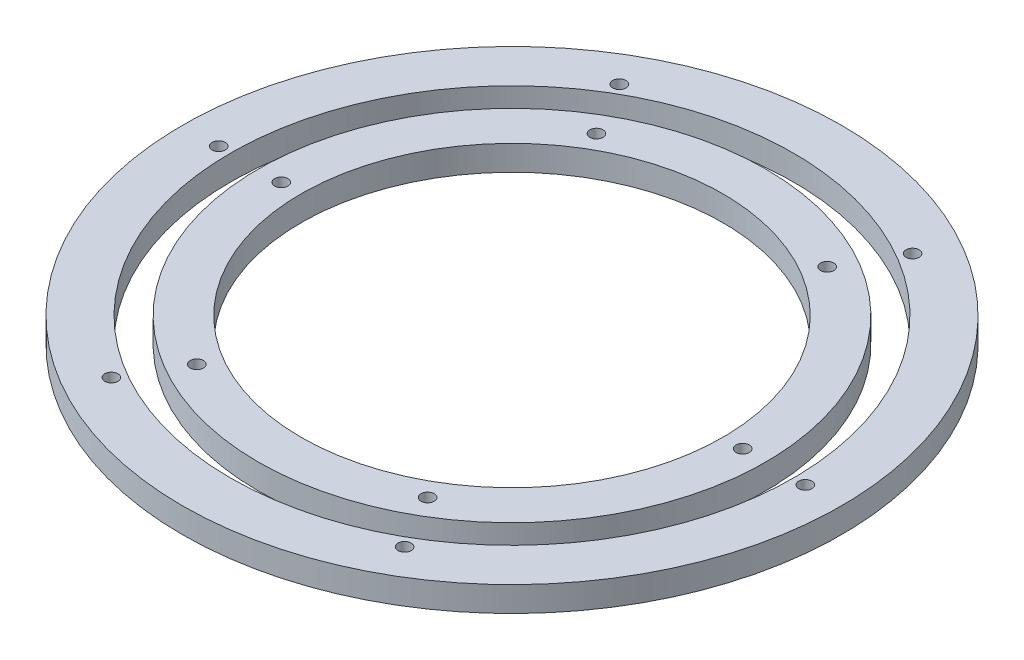
from build123d import *

# Parameters (mm, degrees)
SKETCH1_R           = 250
SKETCH1_R_2         = 160
BOSS_EXTRUDE1_DEPTH = 9.5
SKETCH2_R           = 213.5
SKETCH2_R_2         = 192.5
SKETCH2_R_3         = 5
CUT_EXTRUDE1_DEPTH  = 355.063553617
SKETCH3_R           = 5
CUT_EXTRUDE2_DEPTH  = 355.063553617


with BuildPart() as part:
    # Sketch1 → Boss-Extrude1 (new, symmetric)
    with BuildSketch(Plane(origin=(0, 0, 0), x_dir=(1, 0, 0), z_dir=(0, 1, 0))):
        with Locations(Location((0, 0, 0), (0, 0, 270))):
            Circle(SKETCH1_R)
        with Locations(Location((0, 0, 0), (0, 0, 270))):
            Circle(SKETCH1_R_2, mode=Mode.SUBTRACT)
    extrude(amount=BOSS_EXTRUDE1_DEPTH, both=True)

    # Sketch2 → Cut-Extrude1 (cut, through all)
    # profile 1 of 7: a face of its own
    with BuildSketch(Plane(origin=(0, 9.5, 0), x_dir=(1, 0, 0), z_dir=(0, 1, 0))):
        with Locations(Location((0, 0, 0), (0, 0, 270))):
            Circle(SKETCH2_R)
        with Locations(Location((0, 0, 0), (0, 0, 270))):
            Circle(SKETCH2_R_2, mode=Mode.SUBTRACT)
    # profile 2 of 7: a face of its own
    with BuildSketch(Plane(origin=(0, 9.5, 0), x_dir=(1, 0, 0), z_dir=(0, 1, 0))):
        with Locations(Location((111.25, 192.690652342, 0), (0, 0, 270))):
            Circle(SKETCH2_R_3)
    # profile 3 of 7: a face of its own
    with BuildSketch(Plane(origin=(0, 9.5, 0), x_dir=(1, 0, 0), z_dir=(0, 1, 0))):
        with Locations(Location((222.5, 0, 0), (0, 0, 270))):
            Circle(SKETCH2_R_3)
    # profile 4 of 7: a face of its own
    with BuildSketch(Plane(origin=(0, 9.5, 0), x_dir=(1, 0, 0), z_dir=(0, 1, 0))):
        with Locations(Location((-222.5, 0, 0), (0, 0, 90))):
            Circle(SKETCH2_R_3)
    # profile 5 of 7: a face of its own
    with BuildSketch(Plane(origin=(0, 9.5, 0), x_dir=(1, 0, 0), z_dir=(0, 1, 0))):
        with Locations(Location((-111.25, 192.690652342, 0), (0, 0, 90))):
            Circle(SKETCH2_R_3)
    # profile 6 of 7: a face of its own
    with BuildSketch(Plane(origin=(0, 9.5, 0), x_dir=(1, 0, 0), z_dir=(0, 1, 0))):
        with Locations(Location((111.25, -192.690652342, 0), (0, 0, 90))):
            Circle(SKETCH2_R_3)
    # profile 7 of 7: a face of its own
    with BuildSketch(Plane(origin=(0, 9.5, 0), x_dir=(1, 0, 0), z_dir=(0, 1, 0))):
        with Locations(Location((-111.25, -192.690652342, 0), (0, 0, 270))):
            Circle(SKETCH2_R_3)
    extrude(amount=-CUT_EXTRUDE1_DEPTH, mode=Mode.SUBTRACT)


with BuildPart() as cut_extrude1_piece_1:
    # of the separate pieces the step leaves, piece 1, a body of its own (cut_extrude1_pieces)
    add(part.part.solids().sort_by_distance((0, -9.5, 250))[0])


with BuildPart() as cut_extrude1_piece_2:
    # of the separate pieces the step leaves, piece 2, a body of its own (cut_extrude1_pieces)
    add(part.part.solids().sort_by_distance((0, -9.5, 192.5))[0])

    # Sketch3 → Cut-Extrude2 (cut, through all)
    with BuildSketch(Plane(origin=(0, 9.5, 0), x_dir=(1, 0, 0), z_dir=(0, 1, 0))):
        with Locations(Location((-87.5, 151.554445662, 0), (0, 0, 270))):
            Circle(SKETCH3_R)
        with Locations(Location((-175, 0, 0), (0, 0, 270))):
            Circle(SKETCH3_R)
        with Locations(Location((175, 0, 0), (0, 0, 90))):
            Circle(SKETCH3_R)
        with Locations(Location((87.5, 151.554445662, 0), (0, 0, 90))):
            Circle(SKETCH3_R)
        with Locations(Location((87.5, -151.554445662, 0), (0, 0, 270))):
            Circle(SKETCH3_R)
        with Locations(Location((-87.5, -151.554445662, 0), (0, 0, 90))):
            Circle(SKETCH3_R)
    extrude(amount=-CUT_EXTRUDE2_DEPTH, mode=Mode.SUBTRACT)


solid = Compound([cut_extrude1_piece_1.part, cut_extrude1_piece_2.part])
